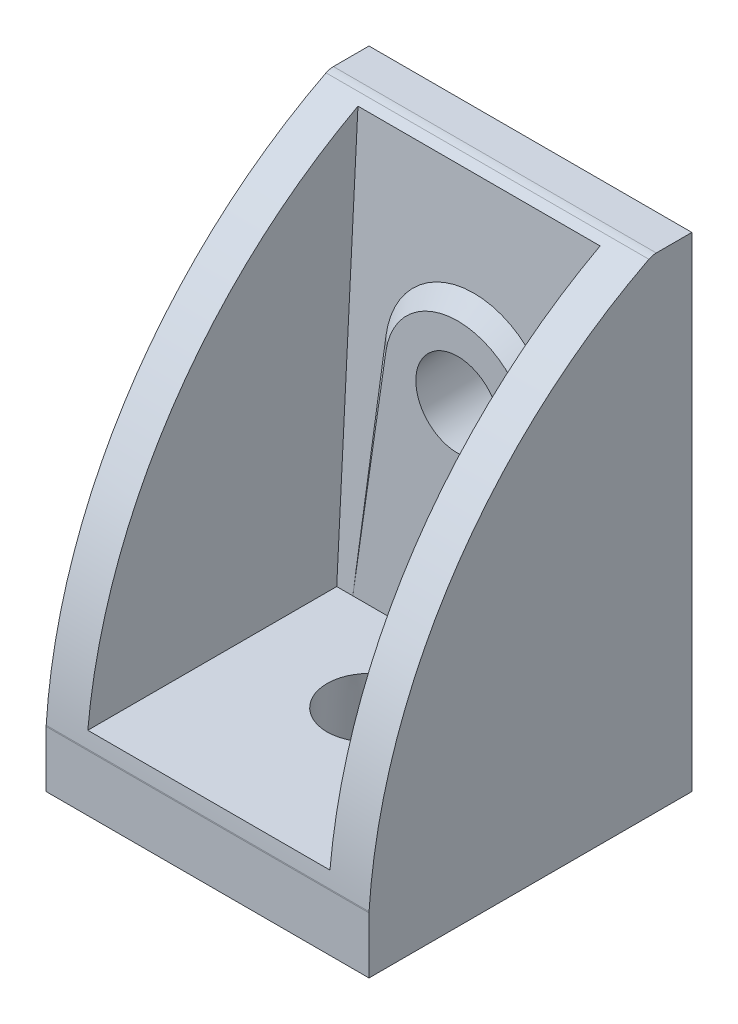
from build123d import *

# Parameters (mm, degrees)
BOSS_EXTRUDE1_DEPTH      = 20
CUT_EXTRUDE1_DEPTH       = 7.5
CUT_EXTRUDE1_DEPTH_BACK  = 7.5
BOSS_EXTRUDE2_DEPTH      = 3
BOSS_EXTRUDE2_DEPTH_BACK = 3
BOSS_EXTRUDE3_DEPTH      = 3
BOSS_EXTRUDE3_DEPTH_BACK = 3
BOSS_EXTRUDE4_DEPTH      = 2
BOSS_EXTRUDE4_DRAFT      = 45
SKETCH6_W                = 5.85
SKETCH6_H                = 5.85
BOSS_EXTRUDE5_DEPTH      = 1.5
BOSS_EXTRUDE5_DRAFT      = -6
CUT_EXTRUDE2_DEPTH       = 1
CUT_EXTRUDE2_DRAFT       = 6


with BuildPart() as part:
    # Sketch1 → Boss-Extrude1 (new body)
    with BuildSketch(Plane(origin=(0, 0, 0), x_dir=(0, 0, -1), z_dir=(1, 0, 0))):
        with BuildLine():
            Line((-20, 3.492090296), (-20, 0))
            Line((-20, 0), (0, 0))
            Line((0, 0), (0, 30))
            Line((0, 30), (-2.204776263, 30))
            ThreePointArc((-2.204776263, 30), (-2.439297051, 29.972111105), (-2.660736787, 29.89))
            ThreePointArc((-2.660736787, 29.89), (-14.796751679, 19.007748284), (-19.997741935, 3.559254499))
            ThreePointArc((-19.997741935, 3.559254499), (-19.999435324, 3.525691371), (-20, 3.492090296))
        make_face()
    extrude(amount=BOSS_EXTRUDE1_DEPTH)

    # Sketch2 → Cut-Extrude1 (cut, two sides: drawn at the far end of the back side and taken through both)
    with BuildSketch(Plane(origin=(10, 0, 0), x_dir=(0, 0, -1), z_dir=(1, 0, 0)).offset(-CUT_EXTRUDE1_DEPTH_BACK)):
        Polygon((-20, 30), (-20, 4.5), (-4.5, 4.5), (-3.163601628, 30), align=None)
    extrude(amount=CUT_EXTRUDE1_DEPTH + CUT_EXTRUDE1_DEPTH_BACK, mode=Mode.SUBTRACT)

    # Sketch3 → Boss-Extrude2 (add, two sides: drawn at the far end of the back side and taken through both)
    with BuildSketch(Plane(origin=(10, 0, 0), x_dir=(0, 0, -1), z_dir=(1, 0, 0)).offset(-BOSS_EXTRUDE2_DEPTH_BACK)):
        Polygon((-0.5, 26.5), (-0.5, 23.5), (1, 24.366025404), (1, 25.633974596), align=None)
    extrude(amount=BOSS_EXTRUDE2_DEPTH + BOSS_EXTRUDE2_DEPTH_BACK)

    # Sketch4 → Boss-Extrude3 (add, two sides: drawn at the far end of the back side and taken through both)
    with BuildSketch(Plane(origin=(10, 0, 0), x_dir=(0, 0, -1), z_dir=(1, 0, 0)).offset(-BOSS_EXTRUDE3_DEPTH_BACK)):
        Polygon((-0.5, 13), (-0.5, 4), (1, 4.866025404), (1, 12.133974596), align=None)
    extrude(amount=BOSS_EXTRUDE3_DEPTH + BOSS_EXTRUDE3_DEPTH_BACK)


with BuildPart() as boss_extrude4_tool:
    # Sketch5 → Boss-Extrude4 (with draft: the straight prism first)
    with BuildSketch(Plane.XY.offset(4.5)):
        with BuildLine():
            Line((3.495537436, 4.5), (16.504462564, 4.5))
            Line((16.504462564, 4.5), (14.453431241, 18.645716799))
            ThreePointArc((14.453431241, 18.645716799), (10, 22.5), (5.546568759, 18.645716799))
            Line((5.546568759, 18.645716799), (3.495537436, 4.5))
        make_face()
    extrude(amount=-BOSS_EXTRUDE4_DEPTH)
    # Boss-Extrude4: the draft: its side faces are tilted about the plane it starts from
    boss_extrude4_sides = [boss_extrude4_tool.faces().sort_by_distance(p)[0] for p in [
        (4.521053098, 11.572858399, 3.5),
        (10, 4.5, 3.5),
        (15.478946902, 11.572858399, 3.5),
        (10, 22.5, 3.5),
    ]]
    draft(boss_extrude4_sides, Plane.XY.offset(4.5), BOSS_EXTRUDE4_DRAFT)


with BuildPart() as part_1:
    add(part.part)

    # Boss-Extrude4: add boss_extrude4_tool
    add(boss_extrude4_tool.part)


with BuildPart() as boss_extrude5_tool:
    # Sketch6 → Boss-Extrude5 (with draft: the straight prism first)
    with BuildSketch(Plane(origin=(0, 0.5, 0), x_dir=(1, 0, 0), z_dir=(0, 1, 0))):
        with Locations((10, -10)):
            Rectangle(SKETCH6_W, SKETCH6_H)
    extrude(amount=-BOSS_EXTRUDE5_DEPTH)
    # Boss-Extrude5: the draft: its side faces are tilted about the plane it starts from
    boss_extrude5_sides = [boss_extrude5_tool.faces().sort_by_distance(p)[0] for p in [
        (10, -0.25, 12.925),
        (12.925, -0.25, 10),
        (10, -0.25, 7.075),
        (7.075, -0.25, 10),
    ]]
    draft(boss_extrude5_sides, Plane(origin=(0, 0.5, 0), x_dir=(1, 0, 0), z_dir=(0, 1, 0)), BOSS_EXTRUDE5_DRAFT)


with BuildPart() as part_2:
    add(part_1.part)

    # Boss-Extrude5: add boss_extrude5_tool
    add(boss_extrude5_tool.part)


with BuildPart() as cut_extrude2_tool:
    # Sketch7 → Cut-Extrude2 (with draft: the straight prism first)
    with BuildSketch(Plane(origin=(0, 0, 0), x_dir=(1, 0, 0), z_dir=(0, 1, 0))):
        Polygon((7.075, -10.835), (9.165, -10.835), (9.165, -12.925), (10.835, -12.925), (10.835, -10.835), (12.925, -10.835), (12.925, -9.165), (10.835, -9.165), (10.835, -7.075), (9.165, -7.075), (9.165, -9.165), (7.075, -9.165), align=None)
    extrude(amount=-CUT_EXTRUDE2_DEPTH)
    # Cut-Extrude2: the draft: its side faces are tilted about the plane it starts from
    cut_extrude2_sides = [cut_extrude2_tool.faces().sort_by_distance(p)[0] for p in [
        (8.12, -0.5, 10.835),
        (9.165, -0.5, 11.88),
        (10, -0.5, 12.925),
        (10.835, -0.5, 11.88),
        (11.88, -0.5, 10.835),
        (12.925, -0.5, 10),
        (11.88, -0.5, 9.165),
        (10.835, -0.5, 8.12),
        (10, -0.5, 7.075),
        (9.165, -0.5, 8.12),
        (8.12, -0.5, 9.165),
        (7.075, -0.5, 10),
    ]]
    draft(cut_extrude2_sides, Plane(origin=(0, 0, 0), x_dir=(1, 0, 0), z_dir=(0, 1, 0)), CUT_EXTRUDE2_DRAFT)


with BuildPart() as part_3:
    add(part_2.part)

    # Cut-Extrude2: cut by cut_extrude2_tool
    add(cut_extrude2_tool.part, mode=Mode.SUBTRACT)

    # Sketch8 → Cut-Revolve1 (revolve, cut)
    with BuildSketch(Plane(origin=(10, 0, 0), x_dir=(0, 0, -1), z_dir=(1, 0, 0)), mode=Mode.PRIVATE) as cut_revolve1_sk:
        Polygon((-4.5, 18), (-4.5, 20.6), (0, 20.835835007), (0, 18), align=None)
    revolve(cut_revolve1_sk.sketch.rotate(Axis((10, 18, 0), (0, 0, 1)), 270), axis=Axis((10, 18, 0), (0, 0, 1)), mode=Mode.SUBTRACT)

    # Sketch9 → Cut-Revolve2 (revolve, cut)
    with BuildSketch(Plane(origin=(10, 0, 0), x_dir=(0, 0, -1), z_dir=(1, 0, 0)), mode=Mode.PRIVATE) as cut_revolve2_sk:
        Polygon((-10, 4.5), (-7.4, 4.5), (-7.111757214, -1), (-10, -1), align=None)
    revolve(cut_revolve2_sk.sketch.rotate(Axis((10, -1, 10), (0, 1, 0)), 17.124314287), axis=Axis((10, -1, 10), (0, 1, 0)), mode=Mode.SUBTRACT)


solid = part_3.part
